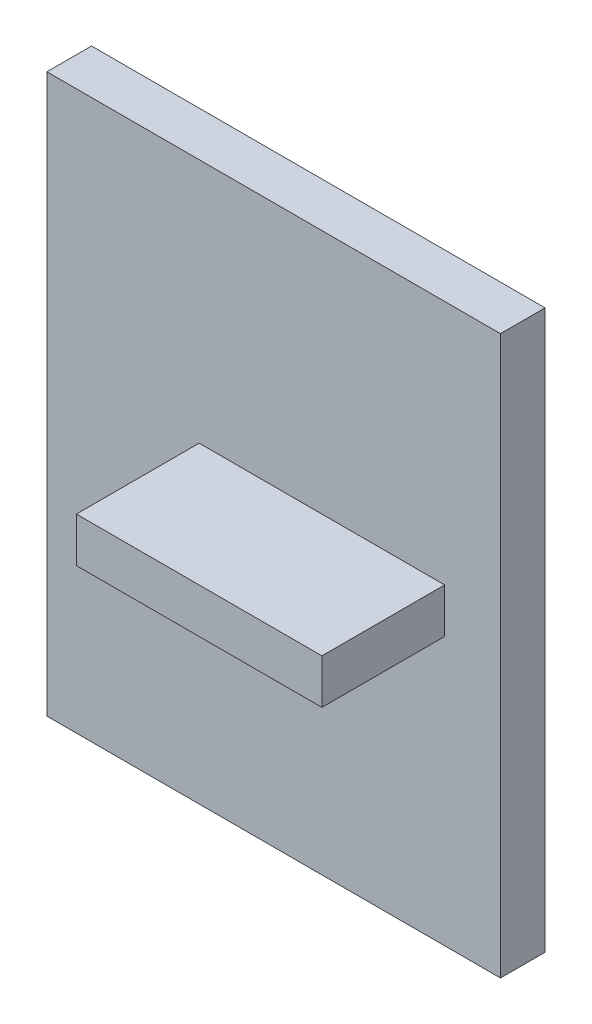
from build123d import *

# Parameters (mm, degrees)
SKETCH1_W           = 203.2
SKETCH1_H           = 250
BOSS_EXTRUDE1_DEPTH = 20
BOSS_EXTRUDE2_START = -20
SKETCH2_W           = 110
SKETCH2_H           = 20
BOSS_EXTRUDE2_DEPTH = 55


with BuildPart() as part:
    # Sketch1 → Boss-Extrude1 (new body)
    with BuildSketch(Plane.XY):
        Rectangle(SKETCH1_W, SKETCH1_H)
    extrude(amount=BOSS_EXTRUDE1_DEPTH)


with BuildPart() as body_2:
    # Sketch2 → Boss-Extrude2 (new body)
    with BuildSketch(Plane(origin=(0, 0, 0), x_dir=(-1, 0, 0), z_dir=(0, 0, -1)).offset(BOSS_EXTRUDE2_START)):
        with Locations((-21.6, 5)):
            Rectangle(SKETCH2_W, SKETCH2_H)
    extrude(amount=-BOSS_EXTRUDE2_DEPTH)


solid = Compound([part.part, body_2.part])
